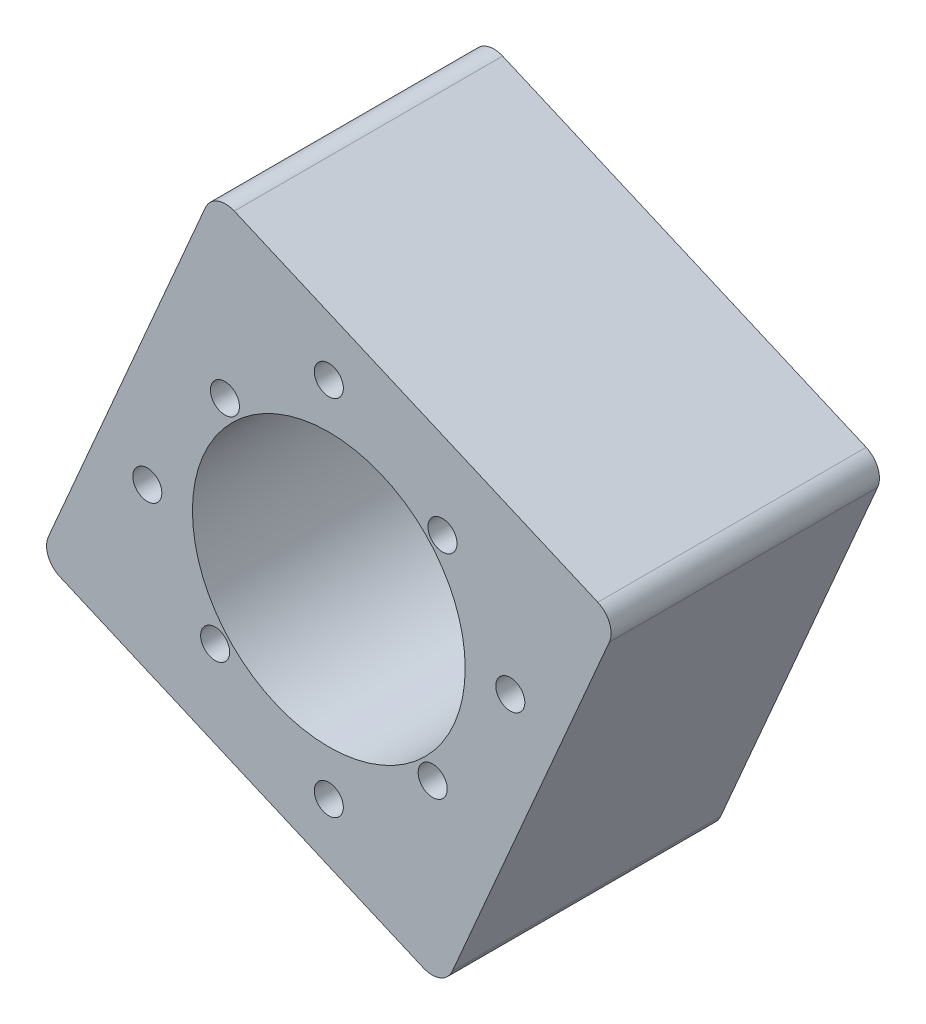
from build123d import *

# Parameters (mm, degrees)
ESQUISSE1_R                                        = 50
BOSS_EXTRU_1_DEPTH                                 = 61
ESQUISSE2_R                                        = 31
ENL_V_MAT_EXTRU_1_DEPTH                            = 72
CHAMBRAGE_POUR_VIS_T_TE_RONDE_BOMB_E_M_D           = 6.6
CHAMBRAGE_POUR_VIS_T_TE_RONDE_BOMB_E_M_CBORE_D     = 13
CHAMBRAGE_POUR_VIS_T_TE_RONDE_BOMB_E_M_CBORE_DEPTH = 4.6
D_GAGEMENT_M61_D                                   = 6.6
D_GAGEMENT_M61_DEPTH                               = 5
D_GAGEMENT_M61_TIP                                 = 1.905255888
BOSS_EXTRU_2_START                                 = -61
BOSS_EXTRU_2_DEPTH                                 = 61
ESQUISSE23_R                                       = 31
ESQUISSE23_R_2                                     = 25
BOSS_EXTRU_3_DEPTH                                 = 7
ESQUISSE24_R                                       = 31
ENL_V_MAT_EXTRU_2_DEPTH                            = 3


with BuildPart() as part:
    # Esquisse1 → Boss.-Extru.1 (new body)
    with BuildSketch(Plane.XY):
        with Locations(Location((0, 0, 0), (0, 0, 180))):
            Circle(ESQUISSE1_R)
    extrude(amount=BOSS_EXTRU_1_DEPTH)

    # Esquisse2 → Enlèv. mat.-Extru.1 (cut)
    with BuildSketch(Plane(origin=(0, 0, 0), x_dir=(-1, 0, 0), z_dir=(0, 0, -1))):
        Circle(ESQUISSE2_R)
    extrude(amount=-ENL_V_MAT_EXTRU_1_DEPTH, mode=Mode.SUBTRACT)

    # Chambrage pour vis à tête ronde bombée M61 (through all)
    with Locations(Plane(origin=(0, 0, 0), x_dir=(-1, 0, 0), z_dir=(0, 0, -1))):
        with Locations((41.25, 0), (0, 41.25), (-41.25, 0), (0, -41.25)):
            CounterBoreHole(CHAMBRAGE_POUR_VIS_T_TE_RONDE_BOMB_E_M_D / 2, CHAMBRAGE_POUR_VIS_T_TE_RONDE_BOMB_E_M_CBORE_D / 2, CHAMBRAGE_POUR_VIS_T_TE_RONDE_BOMB_E_M_CBORE_DEPTH)

    # Dégagement M61
    with Locations(Plane.XY.offset(61)):
        with Locations((-23.608593004, 25.838621023), (-25.838621023, -23.608593004), (23.608593004, -25.838621023), (25.838621023, 23.608593004)):
            Hole(D_GAGEMENT_M61_D / 2, depth=D_GAGEMENT_M61_DEPTH)
            with Locations((0, 0, -(D_GAGEMENT_M61_DEPTH + D_GAGEMENT_M61_TIP / 2))):  # 120° drill point
                Cone(0, D_GAGEMENT_M61_D / 2, D_GAGEMENT_M61_TIP, mode=Mode.SUBTRACT)

    # Esquisse20 → Boss.-Extru.2 (add)
    with BuildSketch(Plane(origin=(0, 0, 0), x_dir=(-1, 0, 0), z_dir=(0, 0, -1)).offset(BOSS_EXTRU_2_START)):
        with BuildLine():
            Line((45.900985342, 19.826738123), (28.056919844, 61.137625476))
            ThreePointArc((28.056919844, 61.137625476), (25.31054896, 63.802603508), (21.484147447, 63.74505007))
            Line((21.484147447, 63.74505007), (-19.826738428, 45.900985211))
            ThreePointArc((-19.826738428, 45.900985211), (18.437276869, 46.476519036), (45.900985342, 19.826738123))
        make_face()
        with BuildLine():
            Line((63.74505007, -21.484147447), (45.900985342, 19.826738123))
            ThreePointArc((45.900985342, 19.826738123), (46.47651917, -18.437276529), (19.826739099, -45.900984921))
            Line((19.826739099, -45.900984921), (61.137625476, -28.056919844))
            ThreePointArc((61.137625476, -28.056919844), (63.802603508, -25.31054896), (63.74505007, -21.484147447))
        make_face()
        with BuildLine():
            ThreePointArc((-45.900984787, -19.82673941), (-46.476519294, 18.437276217), (-19.826738428, 45.900985211))
            Line((-19.826738428, 45.900985211), (-61.137625476, 28.056919844))
            ThreePointArc((-61.137625476, 28.056919844), (-63.802603508, 25.31054896), (-63.74505007, 21.484147447))
            Line((-63.74505007, 21.484147447), (-45.900984787, -19.82673941))
        make_face()
        with BuildLine():
            Line((-21.484147447, -63.74505007), (19.826739099, -45.900984921))
            ThreePointArc((19.826739099, -45.900984921), (-18.437275878, -46.476519429), (-45.900984787, -19.82673941))
            Line((-45.900984787, -19.82673941), (-28.056919844, -61.137625476))
            ThreePointArc((-28.056919844, -61.137625476), (-25.31054896, -63.802603508), (-21.484147447, -63.74505007))
        make_face()
    extrude(amount=BOSS_EXTRU_2_DEPTH)

    # Esquisse23 → Boss.-Extru.3 (add)
    with BuildSketch(Plane(origin=(0, 0, 0), x_dir=(-1, 0, 0), z_dir=(0, 0, -1))):
        Circle(ESQUISSE23_R)
        Circle(ESQUISSE23_R_2, mode=Mode.SUBTRACT)
    extrude(amount=-BOSS_EXTRU_3_DEPTH)

    # Esquisse24 → Enlèv. mat.-Extru.2 (cut)
    with BuildSketch(Plane(origin=(0, 0, 0), x_dir=(-1, 0, 0), z_dir=(0, 0, -1))):
        Circle(ESQUISSE24_R)
    extrude(amount=-ENL_V_MAT_EXTRU_2_DEPTH, mode=Mode.SUBTRACT)


solid = part.part
